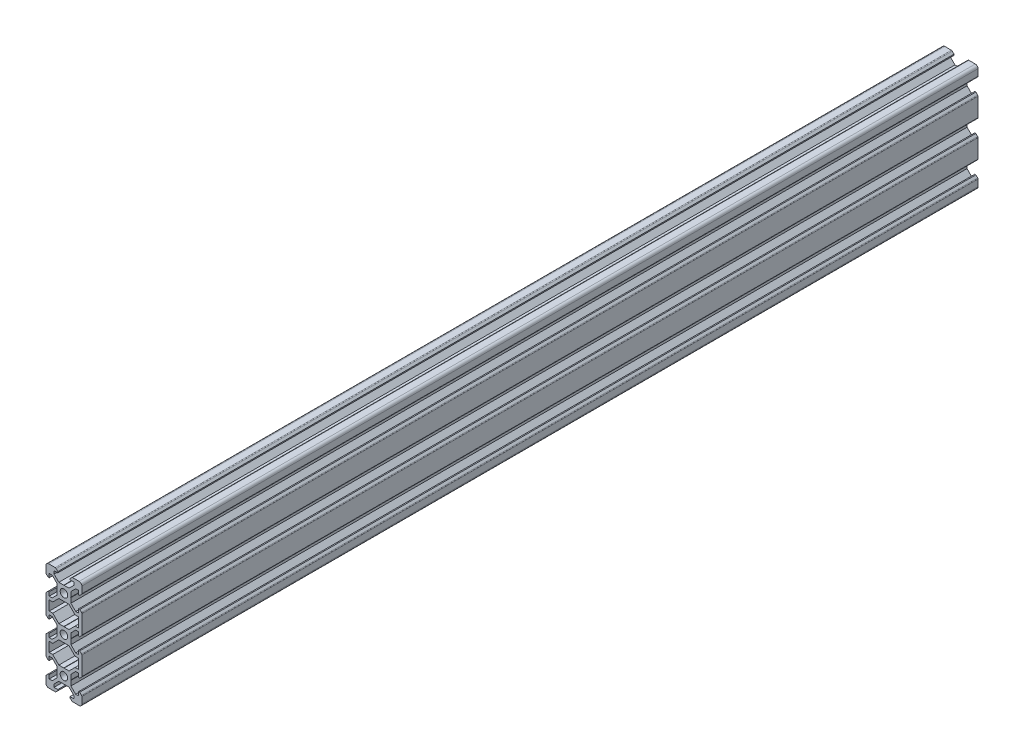
from build123d import *

# Parameters (mm, degrees)
SKETCH1_R           = 2.1
BOSS_EXTRUDE2_DEPTH = 500


with BuildPart() as part:
    # Sketch1 → Boss-Extrude2 (new body)
    with BuildSketch(Plane.XY):
        with BuildLine():
            Line((-8.5, 10), (-4.862792737, 10))
            ThreePointArc((-4.862792737, 10), (-4.598292737, 9.947387679), (-4.374060464, 9.797560464))
            Line((-4.374060464, 9.797560464), (-3.3865, 8.81))
            Line((-3.3865, 8.81), (-3.3865, 8.2))
            Line((-3.3865, 8.2), (-5.5, 8.2))
            Line((-5.5, 8.2), (-5.5, 6.561))
            Line((-5.5, 6.561), (-2.8395, 3.9005))
            Line((-2.8395, 3.9005), (-0.1, 3.9005))
            Line((-0.1, 3.9005), (0, 3.8005))
            Line((0, 3.8005), (0.1, 3.9005))
            Line((0.1, 3.9005), (2.8395, 3.9005))
            Line((2.8395, 3.9005), (5.5, 6.561))
            Line((5.5, 6.561), (5.5, 8.2))
            Line((5.5, 8.2), (3.3865, 8.2))
            Line((3.3865, 8.2), (3.3865, 8.81))
            Line((3.3865, 8.81), (4.374060464, 9.797560464))
            ThreePointArc((4.374060464, 9.797560464), (4.598292737, 9.947387679), (4.862792737, 10))
            Line((4.862792737, 10), (8.5, 10))
            ThreePointArc((8.5, 10), (9.560660172, 9.560660172), (10, 8.5))
            Line((10, 8.5), (10, 4.862792737))
            ThreePointArc((10, 4.862792737), (9.947387679, 4.598292737), (9.797560464, 4.374060464))
            Line((9.797560464, 4.374060464), (8.81, 3.3865))
            Line((8.81, 3.3865), (8.2, 3.3865))
            Line((8.2, 3.3865), (8.2, 5.5))
            Line((8.2, 5.5), (6.561, 5.5))
            Line((6.561, 5.5), (3.9005, 2.8395))
            Line((3.9005, 2.8395), (3.9005, 0.1))
            Line((3.9005, 0.1), (3.8005, 0))
            Line((3.8005, 0), (3.9005, -0.1))
            Line((3.9005, -0.1), (3.9005, -2.8395))
            Line((3.9005, -2.8395), (6.561, -5.5))
            Line((6.561, -5.5), (8.2, -5.5))
            Line((8.2, -5.5), (8.2, -3.3865))
            Line((8.2, -3.3865), (8.81, -3.3865))
            Line((8.81, -3.3865), (9.797560464, -4.374060464))
            ThreePointArc((9.797560464, -4.374060464), (9.947387679, -4.598292737), (10, -4.862792737))
            Line((10, -4.862792737), (10, -15.137207263))
            ThreePointArc((10, -15.137207263), (9.947387679, -15.401707263), (9.797560464, -15.625939536))
            Line((9.797560464, -15.625939536), (8.81, -16.6135))
            Line((8.81, -16.6135), (8.2, -16.6135))
            Line((8.2, -16.6135), (8.2, -14.5))
            Line((8.2, -14.5), (6.561, -14.5))
            Line((6.561, -14.5), (3.9005, -17.1605))
            Line((3.9005, -17.1605), (3.9005, -19.9))
            Line((3.9005, -19.9), (3.8005, -20))
            Line((3.8005, -20), (3.9005, -20.1))
            Line((3.9005, -20.1), (3.9005, -22.8395))
            Line((3.9005, -22.8395), (6.561, -25.5))
            Line((6.561, -25.5), (8.2, -25.5))
            Line((8.2, -25.5), (8.2, -23.3865))
            Line((8.2, -23.3865), (8.81, -23.3865))
            Line((8.81, -23.3865), (9.797560464, -24.374060464))
            ThreePointArc((9.797560464, -24.374060464), (9.947387679, -24.598292737), (10, -24.862792737))
            Line((10, -24.862792737), (10, -35.137207263))
            ThreePointArc((10, -35.137207263), (9.947387679, -35.401707263), (9.797560464, -35.625939536))
            Line((9.797560464, -35.625939536), (8.81, -36.6135))
            Line((8.81, -36.6135), (8.2, -36.6135))
            Line((8.2, -36.6135), (8.2, -34.5))
            Line((8.2, -34.5), (6.561, -34.5))
            Line((6.561, -34.5), (3.9005, -37.1605))
            Line((3.9005, -37.1605), (3.9005, -39.9))
            Line((3.9005, -39.9), (3.8005, -40))
            Line((3.8005, -40), (3.9005, -40.1))
            Line((3.9005, -40.1), (3.9005, -42.8395))
            Line((3.9005, -42.8395), (6.561, -45.5))
            Line((6.561, -45.5), (8.2, -45.5))
            Line((8.2, -45.5), (8.2, -43.3865))
            Line((8.2, -43.3865), (8.81, -43.3865))
            Line((8.81, -43.3865), (9.797560464, -44.374060464))
            ThreePointArc((9.797560464, -44.374060464), (9.947387679, -44.598292737), (10, -44.862792737))
            Line((10, -44.862792737), (10, -48.5))
            ThreePointArc((10, -48.5), (9.560660172, -49.560660172), (8.5, -50))
            Line((8.5, -50), (4.862792737, -50))
            ThreePointArc((4.862792737, -50), (4.598292737, -49.947387679), (4.374060464, -49.797560464))
            Line((4.374060464, -49.797560464), (3.3865, -48.81))
            Line((3.3865, -48.81), (3.3865, -48.2))
            Line((3.3865, -48.2), (5.5, -48.2))
            Line((5.5, -48.2), (5.5, -46.561))
            Line((5.5, -46.561), (2.8395, -43.9005))
            Line((2.8395, -43.9005), (0.1, -43.9005))
            Line((0.1, -43.9005), (0, -43.8005))
            Line((0, -43.8005), (-0.1, -43.9005))
            Line((-0.1, -43.9005), (-2.8395, -43.9005))
            Line((-2.8395, -43.9005), (-5.5, -46.561))
            Line((-5.5, -46.561), (-5.5, -48.2))
            Line((-5.5, -48.2), (-3.3865, -48.2))
            Line((-3.3865, -48.2), (-3.3865, -48.81))
            Line((-3.3865, -48.81), (-4.374060464, -49.797560464))
            ThreePointArc((-4.374060464, -49.797560464), (-4.598292737, -49.947387679), (-4.862792737, -50))
            Line((-4.862792737, -50), (-8.5, -50))
            ThreePointArc((-8.5, -50), (-9.560660172, -49.560660172), (-10, -48.5))
            Line((-10, -48.5), (-10, -44.862792737))
            ThreePointArc((-10, -44.862792737), (-9.947387679, -44.598292737), (-9.797560464, -44.374060464))
            Line((-9.797560464, -44.374060464), (-8.81, -43.3865))
            Line((-8.81, -43.3865), (-8.2, -43.3865))
            Line((-8.2, -43.3865), (-8.2, -45.5))
            Line((-8.2, -45.5), (-6.561, -45.5))
            Line((-6.561, -45.5), (-3.9005, -42.8395))
            Line((-3.9005, -42.8395), (-3.9005, -40.1))
            Line((-3.9005, -40.1), (-3.8005, -40))
            Line((-3.8005, -40), (-3.9005, -39.9))
            Line((-3.9005, -39.9), (-3.9005, -37.1605))
            Line((-3.9005, -37.1605), (-6.561, -34.5))
            Line((-6.561, -34.5), (-8.2, -34.5))
            Line((-8.2, -34.5), (-8.2, -36.6135))
            Line((-8.2, -36.6135), (-8.81, -36.6135))
            Line((-8.81, -36.6135), (-9.797560464, -35.625939536))
            ThreePointArc((-9.797560464, -35.625939536), (-9.947387679, -35.401707263), (-10, -35.137207263))
            Line((-10, -35.137207263), (-10, -24.862792737))
            ThreePointArc((-10, -24.862792737), (-9.947387679, -24.598292737), (-9.797560464, -24.374060464))
            Line((-9.797560464, -24.374060464), (-8.81, -23.3865))
            Line((-8.81, -23.3865), (-8.2, -23.3865))
            Line((-8.2, -23.3865), (-8.2, -25.5))
            Line((-8.2, -25.5), (-6.561, -25.5))
            Line((-6.561, -25.5), (-3.9005, -22.8395))
            Line((-3.9005, -22.8395), (-3.9005, -20.1))
            Line((-3.9005, -20.1), (-3.8005, -20))
            Line((-3.8005, -20), (-3.9005, -19.9))
            Line((-3.9005, -19.9), (-3.9005, -17.1605))
            Line((-3.9005, -17.1605), (-6.561, -14.5))
            Line((-6.561, -14.5), (-8.2, -14.5))
            Line((-8.2, -14.5), (-8.2, -16.6135))
            Line((-8.2, -16.6135), (-8.81, -16.6135))
            Line((-8.81, -16.6135), (-9.797560464, -15.625939536))
            ThreePointArc((-9.797560464, -15.625939536), (-9.947387679, -15.401707263), (-10, -15.137207263))
            Line((-10, -15.137207263), (-10, -4.862792737))
            ThreePointArc((-10, -4.862792737), (-9.947387679, -4.598292737), (-9.797560464, -4.374060464))
            Line((-9.797560464, -4.374060464), (-8.81, -3.3865))
            Line((-8.81, -3.3865), (-8.2, -3.3865))
            Line((-8.2, -3.3865), (-8.2, -5.5))
            Line((-8.2, -5.5), (-6.561, -5.5))
            Line((-6.561, -5.5), (-3.9005, -2.8395))
            Line((-3.9005, -2.8395), (-3.9005, -0.1))
            Line((-3.9005, -0.1), (-3.8005, 0))
            Line((-3.8005, 0), (-3.9005, 0.1))
            Line((-3.9005, 0.1), (-3.9005, 2.8395))
            Line((-3.9005, 2.8395), (-6.561, 5.5))
            Line((-6.561, 5.5), (-8.2, 5.5))
            Line((-8.2, 5.5), (-8.2, 3.3865))
            Line((-8.2, 3.3865), (-8.81, 3.3865))
            Line((-8.81, 3.3865), (-9.797560464, 4.374060464))
            ThreePointArc((-9.797560464, 4.374060464), (-9.947387679, 4.598292737), (-10, 4.862792737))
            Line((-10, 4.862792737), (-10, 8.5))
            ThreePointArc((-10, 8.5), (-9.560660172, 9.560660172), (-8.5, 10))
        make_face()
        Circle(SKETCH1_R, mode=Mode.SUBTRACT)
        with Locations((0, -20)):
            Circle(SKETCH1_R, mode=Mode.SUBTRACT)
        with Locations(Location((0, -40, 0), (0, 0, 180))):
            Circle(SKETCH1_R, mode=Mode.SUBTRACT)
        Polygon((-8.2, -12.7), (-8.2, -7.3), (-6.239, -7.3), (-5.5, -6.561), (-2.8395, -3.9005), (-0.1, -3.9005), (0, -3.8005), (0.1, -3.9005), (2.8395, -3.9005), (5.5, -6.561), (6.239, -7.3), (8.2, -7.3), (8.2, -12.7), (6.239, -12.7), (5.5, -13.439), (2.8395, -16.0995), (0.1, -16.0995), (0, -16.1995), (-0.1, -16.0995), (-2.8395, -16.0995), (-5.5, -13.439), (-6.239, -12.7), align=None, mode=Mode.SUBTRACT)
        Polygon((2.8395, -23.9005), (5.5, -26.561), (6.239, -27.3), (8.2, -27.3), (8.2, -32.7), (6.239, -32.7), (5.5, -33.439), (2.8395, -36.0995), (0.1, -36.0995), (0, -36.1995), (-0.1, -36.0995), (-2.8395, -36.0995), (-5.5, -33.439), (-6.239, -32.7), (-8.2, -32.7), (-8.2, -27.3), (-6.239, -27.3), (-5.5, -26.561), (-2.8395, -23.9005), (-0.1, -23.9005), (0, -23.8005), (0.1, -23.9005), align=None, mode=Mode.SUBTRACT)
    extrude(amount=BOSS_EXTRUDE2_DEPTH)


solid = part.part
